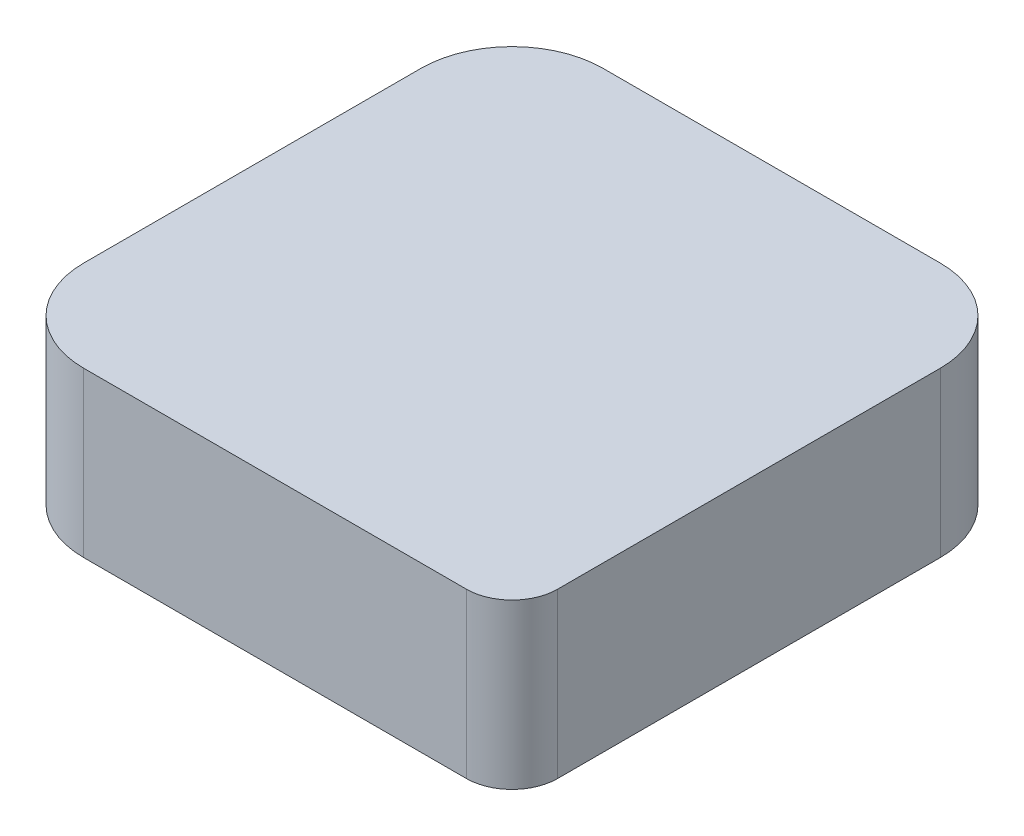
from build123d import *

# Parameters (mm, degrees)
SKETCH1_W           = 57
SKETCH1_H           = 57
BOSS_EXTRUDE1_DEPTH = 18
FILLET1_R           = 5
FILLET2_R           = 10


with BuildPart() as part:
    # Sketch1 → Boss-Extrude1 (new body)
    with BuildSketch(Plane(origin=(0, 0, 0), x_dir=(1, 0, 0), z_dir=(0, 1, 0))):
        with Locations((28.5, 28.5)):
            Rectangle(SKETCH1_W, SKETCH1_H)
    extrude(amount=BOSS_EXTRUDE1_DEPTH)

    # Fillet1
    fillet1_edges = [part.edges().sort_by_distance(p)[0] for p in [
        (57, 9, 0),
    ]]
    fillet(fillet1_edges, radius=FILLET1_R)

    # Fillet2
    fillet2_edges = [part.edges().sort_by_distance(p)[0] for p in [
        (0, 9, -57),
        (57, 9, -57),
        (0, 9, 0),
    ]]
    fillet(fillet2_edges, radius=FILLET2_R)


solid = part.part
